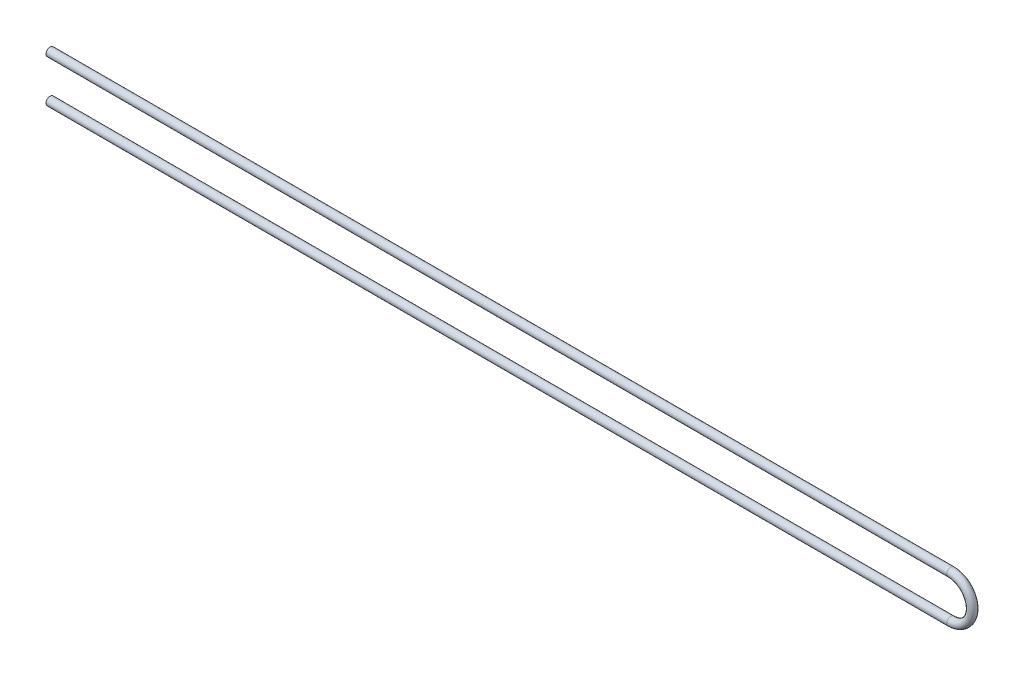
from build123d import *

# Parameters (mm, degrees)
SWEEP_THIN1_PROFILE_R   = 10.65
SWEEP_THIN1_PROFILE_R_2 = 10.15


with BuildPart() as part:
    # Sweep-Thin1: sweep along a path in Sketch1
    with BuildLine(Plane.XY) as sweep_thin1_path:
        Line((0, 0), (2325, 0))
        ThreePointArc((2325, 0), (2380, -55), (2325, -110))
        Line((2325, -110), (0, -110))
    # Sweep-Thin1 profile (on start of the path) → Sweep-Thin1 (sweep)
    with BuildSketch(Plane(origin=(0, 0, 0), x_dir=(0, 0, 1), z_dir=(1, 0, 0))):
        Circle(SWEEP_THIN1_PROFILE_R)
        Circle(SWEEP_THIN1_PROFILE_R_2, mode=Mode.SUBTRACT)
    sweep(path=sweep_thin1_path.line)


solid = part.part
